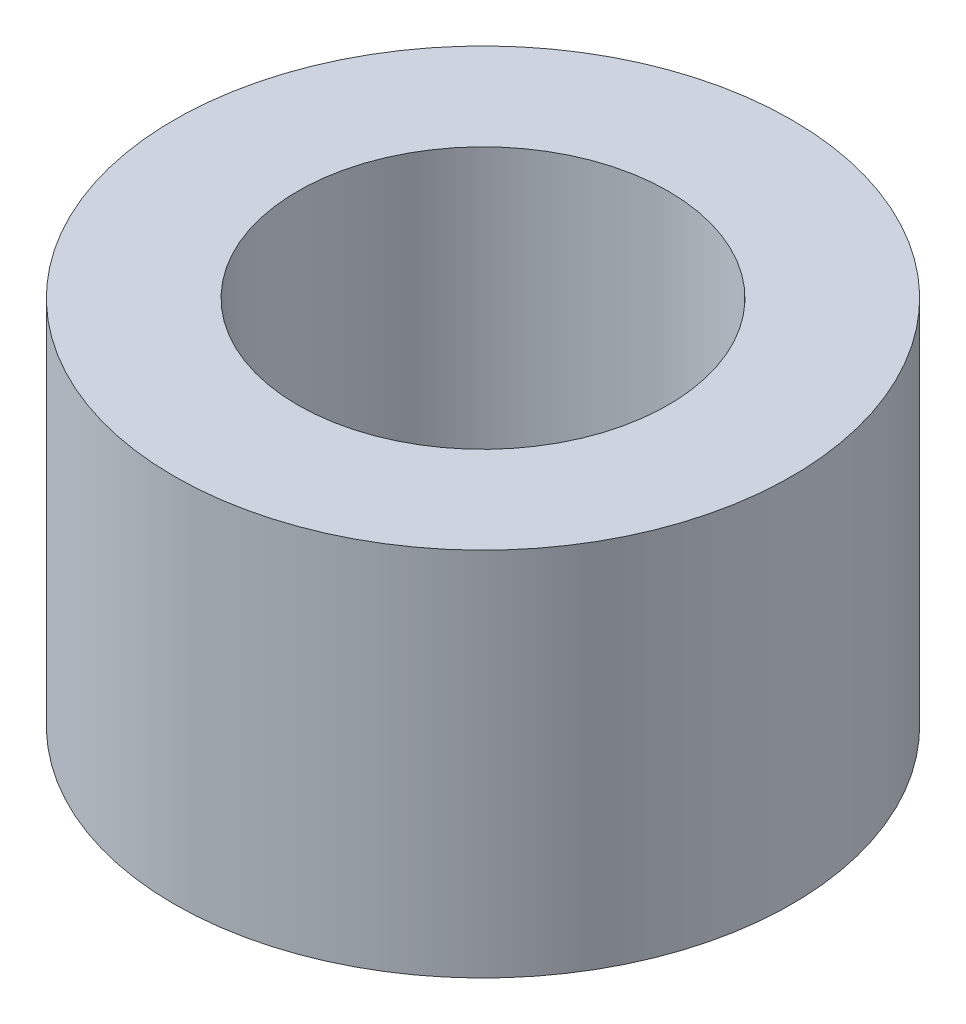
from build123d import *

# Parameters (mm, degrees)
SKETCH1_R           = 3.175
SKETCH1_R_2         = 1.905
BOSS_EXTRUDE1_DEPTH = 15.24
SKETCH2_R           = 3.601177488
CUT_EXTRUDE1_DEPTH  = 11.43


with BuildPart() as part:
    # Sketch1 → Boss-Extrude1 (new body)
    with BuildSketch(Plane(origin=(0, 0, 0), x_dir=(1, 0, 0), z_dir=(0, 1, 0))):
        with Locations(Location((0, 0, 0), (0, 0, 90))):
            Circle(SKETCH1_R)
        with Locations(Location((0, 0, 0), (0, 0, 90))):
            Circle(SKETCH1_R_2, mode=Mode.SUBTRACT)
    extrude(amount=BOSS_EXTRUDE1_DEPTH)

    # Sketch2 → Cut-Extrude1 (cut)
    with BuildSketch(Plane(origin=(0, 15.24, 0), x_dir=(1, 0, 0), z_dir=(0, 1, 0))):
        Circle(SKETCH2_R)
    extrude(amount=-CUT_EXTRUDE1_DEPTH, mode=Mode.SUBTRACT)


solid = part.part
